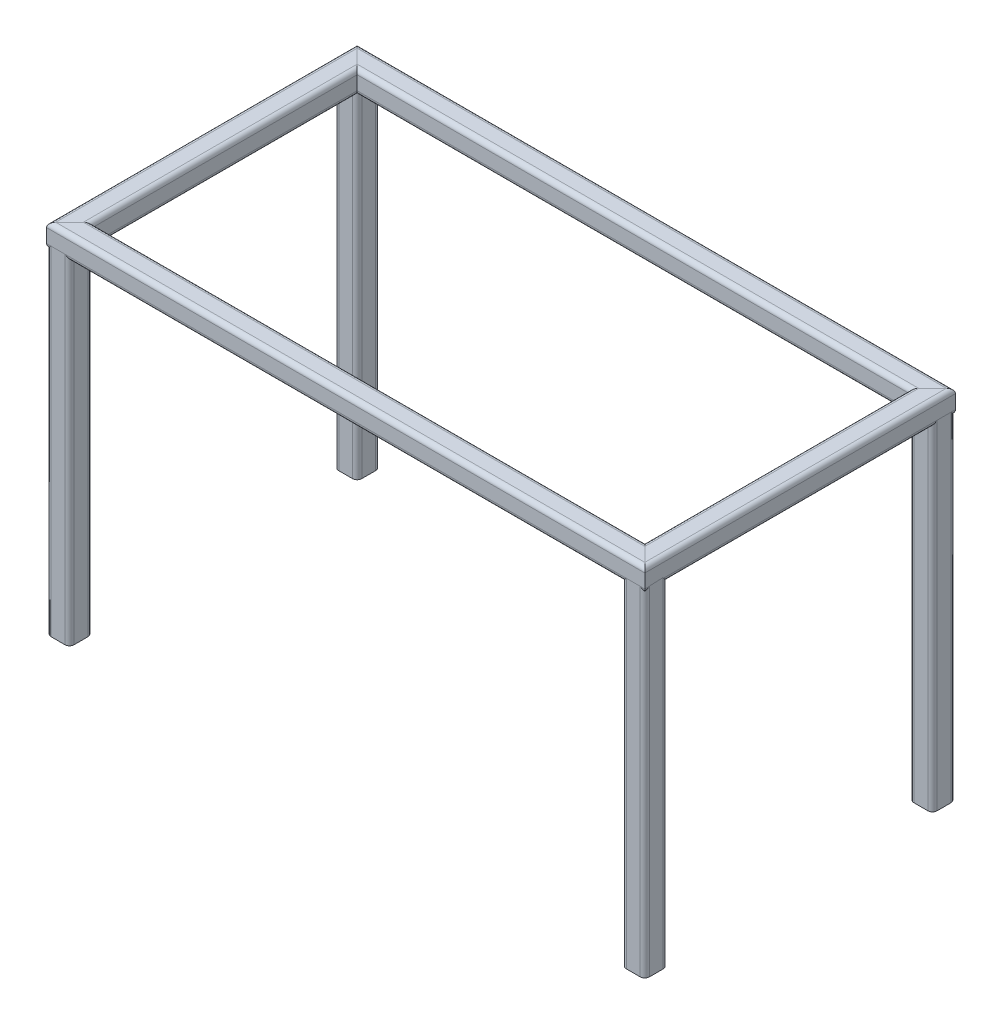
from build123d import *

# Parameters (mm, degrees)
SQUARE_TUBE_40_X_40_X_4_1_DEPTH      = 529.284271247
SQUARE_TUBE_40_X_40_X_4_1_DEPTH_BACK = 29.284271247
SQUARE_TUBE_40_X_40_X_4_1_2_DEPTH    = 1058.568542495
SQUARE_TUBE_40_X_40_X_4_1_3_DEPTH    = 558.568542495
SQUARE_TUBE_40_X_40_X_4_1_4_DEPTH    = 1058.568542495
SQUARE_TUBE_40_X_40_X_4_2_DEPTH      = 600
SQUARE_TUBE_40_X_40_X_4_2_2_DEPTH    = 600
SQUARE_TUBE_40_X_40_X_4_2_3_DEPTH    = 600
SQUARE_TUBE_40_X_40_X_4_2_4_DEPTH    = 600


with BuildPart() as part:
    # Sketch1 → Square tube 40 X 40 X 4(1) (new, two sides: drawn at the far end of the back side and taken through both)
    with BuildSketch(Plane.XY.offset(-SQUARE_TUBE_40_X_40_X_4_1_DEPTH_BACK)):
        with BuildLine():
            Line((-12, -20), (12, -20))
            ThreePointArc((12, -20), (17.656854249, -17.656854249), (20, -12))
            Line((20, -12), (20, 12))
            ThreePointArc((20, 12), (17.656854249, 17.656854249), (12, 20))
            Line((12, 20), (-12, 20))
            ThreePointArc((-12, 20), (-17.656854249, 17.656854249), (-20, 12))
            Line((-20, 12), (-20, -12))
            ThreePointArc((-20, -12), (-17.656854249, -17.656854249), (-12, -20))
        make_face()
        with BuildLine():
            Line((-12, -16), (12, -16))
            ThreePointArc((12, -16), (14.828427125, -14.828427125), (16, -12))
            Line((16, -12), (16, 12))
            ThreePointArc((16, 12), (14.828427125, 14.828427125), (12, 16))
            Line((12, 16), (-12, 16))
            ThreePointArc((-12, 16), (-14.828427125, 14.828427125), (-16, 12))
            Line((-16, 12), (-16, -12))
            ThreePointArc((-16, -12), (-14.828427125, -14.828427125), (-12, -16))
        make_face(mode=Mode.SUBTRACT)
    extrude(amount=SQUARE_TUBE_40_X_40_X_4_1_DEPTH + SQUARE_TUBE_40_X_40_X_4_1_DEPTH_BACK)

    # Square tube 40 X 40 X 4(1) mitre 1
    split(bisect_by=Plane(origin=(0, 0, 0), x_dir=(0, -1, 0), z_dir=(-0.707106781, 0, 0.707106781)), keep=Keep.TOP)

    # Square tube 40 X 40 X 4(1) mitre 2
    split(bisect_by=Plane(origin=(0, 0, 500), x_dir=(0, -1, 0), z_dir=(-0.707106781, 0, -0.707106781)), keep=Keep.TOP)


with BuildPart() as body_2:
    # Sketch1 on segment 2 (carried to segment 2) → Square tube 40 X 40 X 4_1 2 (new body)
    with BuildSketch(Plane(origin=(-29.284271247, 0, 500), x_dir=(0, 0, -1), z_dir=(1, 0, 0))):
        with BuildLine():
            Line((-12, -20), (12, -20))
            ThreePointArc((12, -20), (17.656854249, -17.656854249), (20, -12))
            Line((20, -12), (20, 12))
            ThreePointArc((20, 12), (17.656854249, 17.656854249), (12, 20))
            Line((12, 20), (-12, 20))
            ThreePointArc((-12, 20), (-17.656854249, 17.656854249), (-20, 12))
            Line((-20, 12), (-20, -12))
            ThreePointArc((-20, -12), (-17.656854249, -17.656854249), (-12, -20))
        make_face()
        with BuildLine():
            Line((-12, -16), (12, -16))
            ThreePointArc((12, -16), (14.828427125, -14.828427125), (16, -12))
            Line((16, -12), (16, 12))
            ThreePointArc((16, 12), (14.828427125, 14.828427125), (12, 16))
            Line((12, 16), (-12, 16))
            ThreePointArc((-12, 16), (-14.828427125, 14.828427125), (-16, 12))
            Line((-16, 12), (-16, -12))
            ThreePointArc((-16, -12), (-14.828427125, -14.828427125), (-12, -16))
        make_face(mode=Mode.SUBTRACT)
    extrude(amount=SQUARE_TUBE_40_X_40_X_4_1_2_DEPTH)

    # Square tube 40 X 40 X 4_1 2 mitre 1
    split(bisect_by=Plane(origin=(0, 0, 500), x_dir=(0, 1, 0), z_dir=(0.707106781, 0, 0.707106781)), keep=Keep.TOP)

    # Square tube 40 X 40 X 4_1 2 mitre 2
    split(bisect_by=Plane(origin=(1000, 0, 500), x_dir=(0, -1, 0), z_dir=(-0.707106781, 0, 0.707106781)), keep=Keep.TOP)


with BuildPart() as body_3:
    # Sketch1 on segment 3 (carried to segment 3) → Square tube 40 X 40 X 4_1 3 (new body)
    with BuildSketch(Plane(origin=(1000, 0, 529.284271247), x_dir=(-1, 0, 0), z_dir=(0, 0, -1))):
        with BuildLine():
            Line((-12, -20), (12, -20))
            ThreePointArc((12, -20), (17.656854249, -17.656854249), (20, -12))
            Line((20, -12), (20, 12))
            ThreePointArc((20, 12), (17.656854249, 17.656854249), (12, 20))
            Line((12, 20), (-12, 20))
            ThreePointArc((-12, 20), (-17.656854249, 17.656854249), (-20, 12))
            Line((-20, 12), (-20, -12))
            ThreePointArc((-20, -12), (-17.656854249, -17.656854249), (-12, -20))
        make_face()
        with BuildLine():
            Line((-12, -16), (12, -16))
            ThreePointArc((12, -16), (14.828427125, -14.828427125), (16, -12))
            Line((16, -12), (16, 12))
            ThreePointArc((16, 12), (14.828427125, 14.828427125), (12, 16))
            Line((12, 16), (-12, 16))
            ThreePointArc((-12, 16), (-14.828427125, 14.828427125), (-16, 12))
            Line((-16, 12), (-16, -12))
            ThreePointArc((-16, -12), (-14.828427125, -14.828427125), (-12, -16))
        make_face(mode=Mode.SUBTRACT)
    extrude(amount=SQUARE_TUBE_40_X_40_X_4_1_3_DEPTH)

    # Square tube 40 X 40 X 4_1 3 mitre 1
    split(bisect_by=Plane(origin=(1000, 0, 0), x_dir=(0, 1, 0), z_dir=(0.707106781, 0, 0.707106781)), keep=Keep.TOP)

    # Square tube 40 X 40 X 4_1 3 mitre 2
    split(bisect_by=Plane(origin=(1000, 0, 500), x_dir=(0, 1, 0), z_dir=(0.707106781, 0, -0.707106781)), keep=Keep.TOP)


with BuildPart() as body_4:
    # Sketch1 on segment 4 (carried to segment 4) → Square tube 40 X 40 X 4_1 4 (new body)
    with BuildSketch(Plane.ZY.offset(-1029.284271247)):
        with BuildLine():
            Line((-12, -20), (12, -20))
            ThreePointArc((12, -20), (17.656854249, -17.656854249), (20, -12))
            Line((20, -12), (20, 12))
            ThreePointArc((20, 12), (17.656854249, 17.656854249), (12, 20))
            Line((12, 20), (-12, 20))
            ThreePointArc((-12, 20), (-17.656854249, 17.656854249), (-20, 12))
            Line((-20, 12), (-20, -12))
            ThreePointArc((-20, -12), (-17.656854249, -17.656854249), (-12, -20))
        make_face()
        with BuildLine():
            Line((-12, -16), (12, -16))
            ThreePointArc((12, -16), (14.828427125, -14.828427125), (16, -12))
            Line((16, -12), (16, 12))
            ThreePointArc((16, 12), (14.828427125, 14.828427125), (12, 16))
            Line((12, 16), (-12, 16))
            ThreePointArc((-12, 16), (-14.828427125, 14.828427125), (-16, 12))
            Line((-16, 12), (-16, -12))
            ThreePointArc((-16, -12), (-14.828427125, -14.828427125), (-12, -16))
        make_face(mode=Mode.SUBTRACT)
    extrude(amount=SQUARE_TUBE_40_X_40_X_4_1_4_DEPTH)

    # Square tube 40 X 40 X 4_1 4 mitre 1
    split(bisect_by=Plane(origin=(0, 0, 0), x_dir=(0, 1, 0), z_dir=(0.707106781, 0, -0.707106781)), keep=Keep.TOP)

    # Square tube 40 X 40 X 4_1 4 mitre 2
    split(bisect_by=Plane(origin=(1000, 0, 0), x_dir=(0, -1, 0), z_dir=(-0.707106781, 0, -0.707106781)), keep=Keep.TOP)


with BuildPart() as body_5:
    # Sketch11 → Square tube 40 X 40 X 4(2) (new body)
    with BuildSketch(Plane(origin=(0, 0, 500), x_dir=(1, 0, 0), z_dir=(0, -1, 0))):
        with BuildLine():
            Line((-12, -20), (12, -20))
            ThreePointArc((12, -20), (17.656854249, -17.656854249), (20, -12))
            Line((20, -12), (20, 12))
            ThreePointArc((20, 12), (17.656854249, 17.656854249), (12, 20))
            Line((12, 20), (-12, 20))
            ThreePointArc((-12, 20), (-17.656854249, 17.656854249), (-20, 12))
            Line((-20, 12), (-20, -12))
            ThreePointArc((-20, -12), (-17.656854249, -17.656854249), (-12, -20))
        make_face()
        with BuildLine():
            Line((-12, -16), (12, -16))
            ThreePointArc((12, -16), (14.828427125, -14.828427125), (16, -12))
            Line((16, -12), (16, 12))
            ThreePointArc((16, 12), (14.828427125, 14.828427125), (12, 16))
            Line((12, 16), (-12, 16))
            ThreePointArc((-12, 16), (-14.828427125, 14.828427125), (-16, 12))
            Line((-16, 12), (-16, -12))
            ThreePointArc((-16, -12), (-14.828427125, -14.828427125), (-12, -16))
        make_face(mode=Mode.SUBTRACT)
    extrude(amount=SQUARE_TUBE_40_X_40_X_4_2_DEPTH)


with BuildPart() as body_6:
    # Sketch11 on segment 2 (carried to segment 2) → Square tube 40 X 40 X 4_2 2 (new body)
    with BuildSketch(Plane(origin=(1000, 0, 500), x_dir=(1, 0, 0), z_dir=(0, -1, 0))):
        with BuildLine():
            Line((-12, -20), (12, -20))
            ThreePointArc((12, -20), (17.656854249, -17.656854249), (20, -12))
            Line((20, -12), (20, 12))
            ThreePointArc((20, 12), (17.656854249, 17.656854249), (12, 20))
            Line((12, 20), (-12, 20))
            ThreePointArc((-12, 20), (-17.656854249, 17.656854249), (-20, 12))
            Line((-20, 12), (-20, -12))
            ThreePointArc((-20, -12), (-17.656854249, -17.656854249), (-12, -20))
        make_face()
        with BuildLine():
            Line((-12, -16), (12, -16))
            ThreePointArc((12, -16), (14.828427125, -14.828427125), (16, -12))
            Line((16, -12), (16, 12))
            ThreePointArc((16, 12), (14.828427125, 14.828427125), (12, 16))
            Line((12, 16), (-12, 16))
            ThreePointArc((-12, 16), (-14.828427125, 14.828427125), (-16, 12))
            Line((-16, 12), (-16, -12))
            ThreePointArc((-16, -12), (-14.828427125, -14.828427125), (-12, -16))
        make_face(mode=Mode.SUBTRACT)
    extrude(amount=SQUARE_TUBE_40_X_40_X_4_2_2_DEPTH)


with BuildPart() as body_7:
    # Sketch11 on segment 3 (carried to segment 3) → Square tube 40 X 40 X 4_2 3 (new body)
    with BuildSketch(Plane(origin=(1000, 0, 0), x_dir=(1, 0, 0), z_dir=(0, -1, 0))):
        with BuildLine():
            Line((-12, -20), (12, -20))
            ThreePointArc((12, -20), (17.656854249, -17.656854249), (20, -12))
            Line((20, -12), (20, 12))
            ThreePointArc((20, 12), (17.656854249, 17.656854249), (12, 20))
            Line((12, 20), (-12, 20))
            ThreePointArc((-12, 20), (-17.656854249, 17.656854249), (-20, 12))
            Line((-20, 12), (-20, -12))
            ThreePointArc((-20, -12), (-17.656854249, -17.656854249), (-12, -20))
        make_face()
        with BuildLine():
            Line((-12, -16), (12, -16))
            ThreePointArc((12, -16), (14.828427125, -14.828427125), (16, -12))
            Line((16, -12), (16, 12))
            ThreePointArc((16, 12), (14.828427125, 14.828427125), (12, 16))
            Line((12, 16), (-12, 16))
            ThreePointArc((-12, 16), (-14.828427125, 14.828427125), (-16, 12))
            Line((-16, 12), (-16, -12))
            ThreePointArc((-16, -12), (-14.828427125, -14.828427125), (-12, -16))
        make_face(mode=Mode.SUBTRACT)
    extrude(amount=SQUARE_TUBE_40_X_40_X_4_2_3_DEPTH)


with BuildPart() as body_8:
    # Sketch11 on segment 4 (carried to segment 4) → Square tube 40 X 40 X 4_2 4 (new body)
    with BuildSketch(Plane.XZ):
        with BuildLine():
            Line((-12, -20), (12, -20))
            ThreePointArc((12, -20), (17.656854249, -17.656854249), (20, -12))
            Line((20, -12), (20, 12))
            ThreePointArc((20, 12), (17.656854249, 17.656854249), (12, 20))
            Line((12, 20), (-12, 20))
            ThreePointArc((-12, 20), (-17.656854249, 17.656854249), (-20, 12))
            Line((-20, 12), (-20, -12))
            ThreePointArc((-20, -12), (-17.656854249, -17.656854249), (-12, -20))
        make_face()
        with BuildLine():
            Line((-12, -16), (12, -16))
            ThreePointArc((12, -16), (14.828427125, -14.828427125), (16, -12))
            Line((16, -12), (16, 12))
            ThreePointArc((16, 12), (14.828427125, 14.828427125), (12, 16))
            Line((12, 16), (-12, 16))
            ThreePointArc((-12, 16), (-14.828427125, 14.828427125), (-16, 12))
            Line((-16, 12), (-16, -12))
            ThreePointArc((-16, -12), (-14.828427125, -14.828427125), (-12, -16))
        make_face(mode=Mode.SUBTRACT)
    extrude(amount=SQUARE_TUBE_40_X_40_X_4_2_4_DEPTH)


solid = Compound([part.part, body_2.part, body_3.part, body_4.part, body_5.part, body_6.part, body_7.part, body_8.part])
